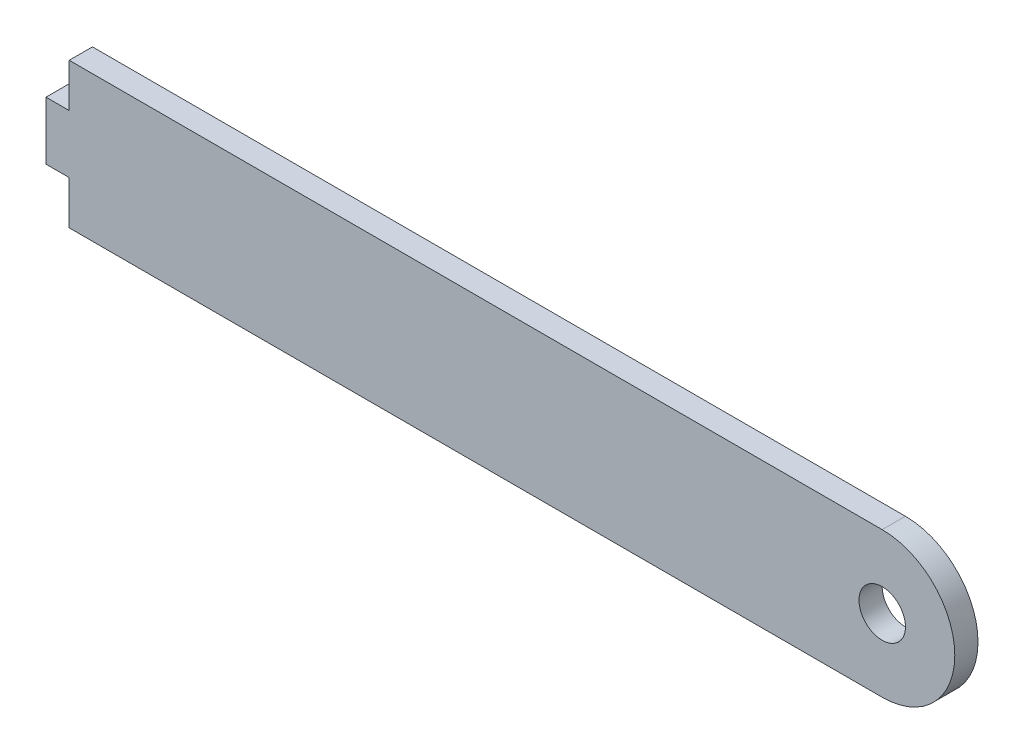
from build123d import *

# Parameters (mm, degrees)
SKETCH2_R           = 4
BOSS_EXTRUDE1_DEPTH = 4


with BuildPart() as part:
    # Sketch2 → Boss-Extrude1 (new body)
    with BuildSketch(Plane.XY):
        with BuildLine():
            Line((-48.202812442, -6.461632916), (-48.202812442, -13.961632916))
            Line((-48.202812442, -13.961632916), (91.797187558, -13.961632916))
            ThreePointArc((91.797187558, -13.961632916), (104.297187558, -1.461632916), (91.797187558, 11.038367084))
            Line((91.797187558, 11.038367084), (-48.202812442, 11.038367084))
            Line((-48.202812442, 11.038367084), (-48.202812442, 3.538367084))
            Line((-48.202812442, 3.538367084), (-52.202812442, 3.538367084))
            Line((-52.202812442, 3.538367084), (-52.202812442, -6.461632916))
            Line((-52.202812442, -6.461632916), (-48.202812442, -6.461632916))
        make_face()
        with Locations((91.797187558, -1.461632916)):
            Circle(SKETCH2_R, mode=Mode.SUBTRACT)
    extrude(amount=BOSS_EXTRUDE1_DEPTH)


solid = part.part
